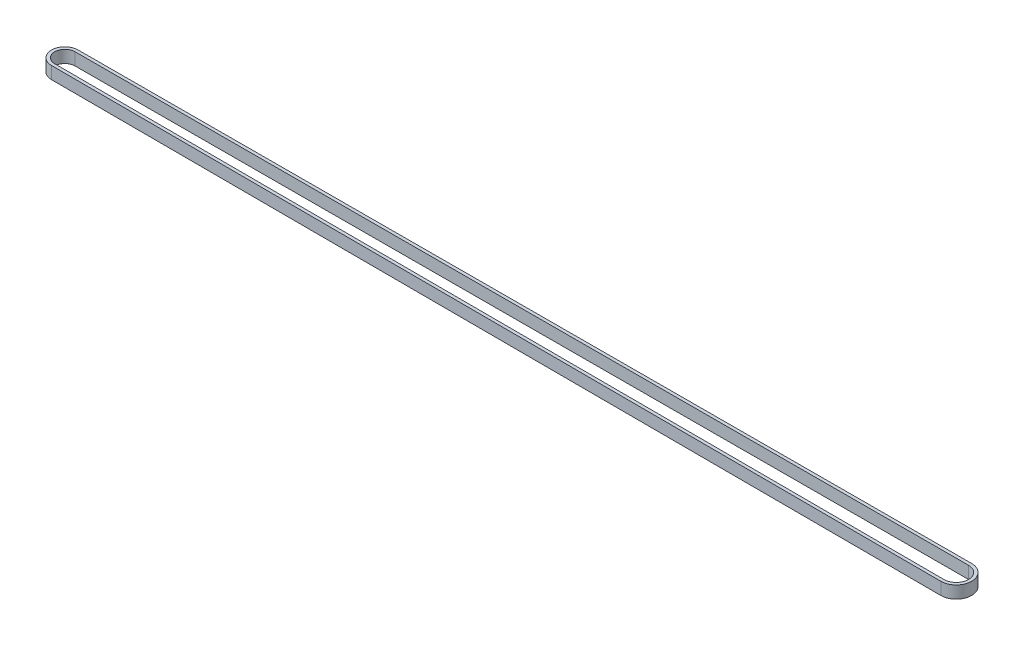
from build123d import *

# Parameters (mm, degrees)
SALIENTE_EXTRUIR1_DEPTH = 6


with BuildPart() as part:
    # Croquis1 → Saliente-Extruir1 (new body)
    with BuildSketch(Plane(origin=(0, 0, 0), x_dir=(1, 0, 0), z_dir=(0, 1, 0))):
        with BuildLine():
            Line((-60.144987318, 6.499982722), (373.55270694, 7.499980063))
            ThreePointArc((373.55270694, 7.499980063), (381.07, 0), (373.55270694, -7.499980063))
            Line((373.55270694, -7.499980063), (-60.144987318, -6.499982722))
            ThreePointArc((-60.144987318, -6.499982722), (-66.63, 0), (-60.144987318, 6.499982722))
        make_face()
        with BuildLine():
            Line((-60.141528706, 4.999986709), (373.556165552, 5.999984051))
            ThreePointArc((373.556165552, 5.999984051), (379.57, 0), (373.556165552, -5.999984051))
            Line((373.556165552, -5.999984051), (-60.141528706, -4.999986709))
            ThreePointArc((-60.141528706, -4.999986709), (-65.13, 0), (-60.141528706, 4.999986709))
        make_face(mode=Mode.SUBTRACT)
    extrude(amount=SALIENTE_EXTRUIR1_DEPTH)


solid = part.part
